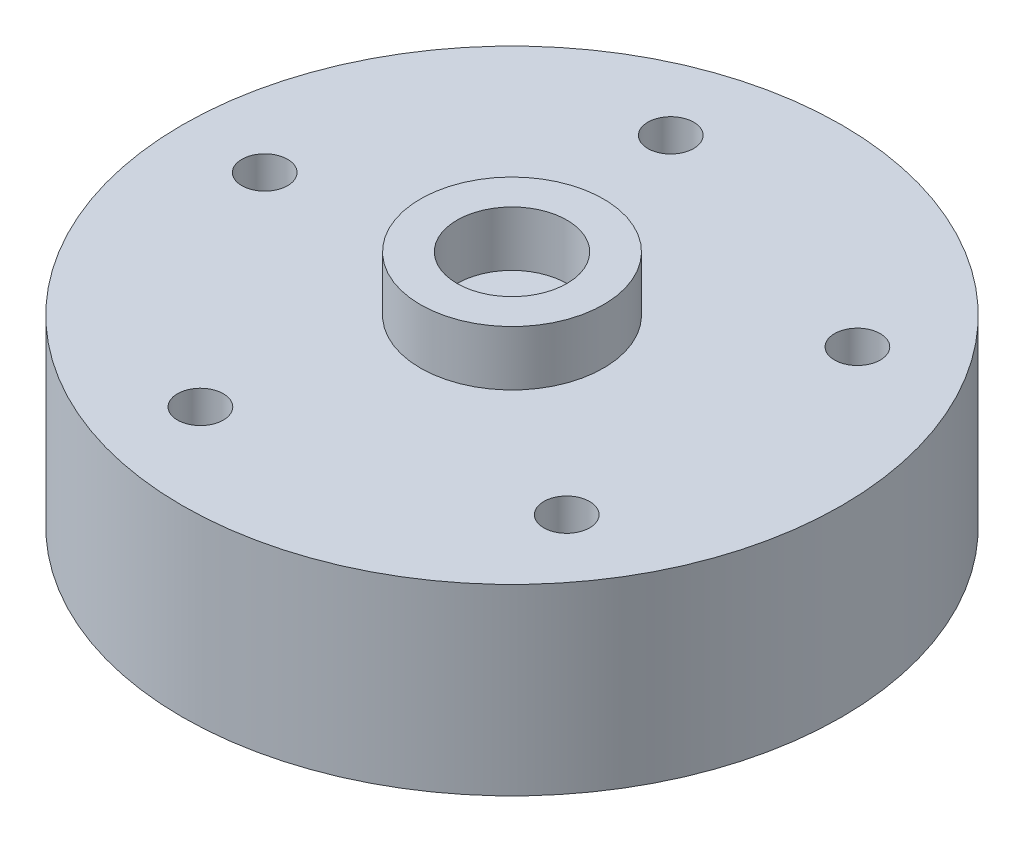
from build123d import *

# Parameters (mm, degrees)
BOSS_EXTRUDE1_DEPTH      = 2
BOSS_EXTRUDE1_DEPTH_BACK = 3
SKETCH1_R                = 16
SKETCH1_R_2              = 1.25
SKETCH2_R                = 5
SKETCH2_R_2              = 3
BOSS_EXTRUDE3_DEPTH      = 3
SKETCH5_R                = 2.75
CUT_EXTRUDE2_DEPTH       = 1
SKETCH6_R                = 16
SKETCH6_R_2              = 11
SKETCH6_R_3              = 1.25
BOSS_EXTRUDE4_DEPTH      = 5
SKETCH7_R                = 18
SKETCH7_R_2              = 16
BOSS_EXTRUDE5_DEPTH      = 10
SKETCH8_R                = 2
CUT_EXTRUDE3_DEPTH       = 3
SKETCH9_R                = 3.75
CUT_EXTRUDE4_DEPTH       = 2


with BuildPart() as part:
    # Sketch1 → Boss-Extrude1 (new, two sides: drawn at the far end of the back side and taken through both)
    with BuildSketch(Plane(origin=(0, 0, 0), x_dir=(1, 0, 0), z_dir=(0, 1, 0)).offset(-BOSS_EXTRUDE1_DEPTH_BACK)):
        with Locations(Location((0, 0, 0), (0, 0, 270))):
            Circle(SKETCH1_R)
        with Locations(Location((0, 0, 0), (0, 0, 270))):
            Circle(SKETCH1_R_2, mode=Mode.SUBTRACT)
        with Locations(Location((-13.5, 0, 0), (0, 0, 270))):
            Circle(SKETCH1_R_2, mode=Mode.SUBTRACT)
        with Locations(Location((-4.171729424, 12.83926297, 0), (0, 0, 270))):
            Circle(SKETCH1_R_2, mode=Mode.SUBTRACT)
        with Locations(Location((10.921729424, 7.935100906, 0), (0, 0, 270))):
            Circle(SKETCH1_R_2, mode=Mode.SUBTRACT)
        with Locations(Location((10.921729424, -7.935100906, 0), (0, 0, 270))):
            Circle(SKETCH1_R_2, mode=Mode.SUBTRACT)
        with Locations(Location((-4.171729424, -12.83926297, 0), (0, 0, 270))):
            Circle(SKETCH1_R_2, mode=Mode.SUBTRACT)
    extrude(amount=BOSS_EXTRUDE1_DEPTH + BOSS_EXTRUDE1_DEPTH_BACK)

    # Sketch2 → Boss-Extrude3 (add)
    with BuildSketch(Plane(origin=(0, 2, 0), x_dir=(1, 0, 0), z_dir=(0, 1, 0))):
        with Locations(Location((0, 0, 0), (0, 0, 270))):
            Circle(SKETCH2_R)
        with Locations(Location((0, 0, 0), (0, 0, 270))):
            Circle(SKETCH2_R_2, mode=Mode.SUBTRACT)
    extrude(amount=BOSS_EXTRUDE3_DEPTH)

    # Sketch5 → Cut-Extrude2 (cut)
    with BuildSketch(Plane.XZ.offset(3)):
        with Locations(Location((0, 0, 0), (0, 0, 270))):
            Circle(SKETCH5_R)
    extrude(amount=-CUT_EXTRUDE2_DEPTH, mode=Mode.SUBTRACT)

    # Sketch6 → Boss-Extrude4 (add)
    with BuildSketch(Plane.XZ.offset(3)):
        with Locations(Location((0, 0, 0), (0, 0, 90))):
            Circle(SKETCH6_R)
        with Locations(Location((0, 0, 0), (0, 0, 270))):
            Circle(SKETCH6_R_2, mode=Mode.SUBTRACT)
        with Locations(Location((-13.5, 0, 0), (0, 0, 90))):
            Circle(SKETCH6_R_3, mode=Mode.SUBTRACT)
        with Locations(Location((-4.171729424, 12.83926297, 0), (0, 0, 90))):
            Circle(SKETCH6_R_3, mode=Mode.SUBTRACT)
        with Locations(Location((10.921729424, 7.935100906, 0), (0, 0, 90))):
            Circle(SKETCH6_R_3, mode=Mode.SUBTRACT)
        with Locations(Location((10.921729424, -7.935100906, 0), (0, 0, 90))):
            Circle(SKETCH6_R_3, mode=Mode.SUBTRACT)
        with Locations(Location((-4.171729424, -12.83926297, 0), (0, 0, 90))):
            Circle(SKETCH6_R_3, mode=Mode.SUBTRACT)
    extrude(amount=BOSS_EXTRUDE4_DEPTH)

    # Sketch7 → Boss-Extrude5 (add)
    with BuildSketch(Plane(origin=(0, 2, 0), x_dir=(1, 0, 0), z_dir=(0, 1, 0))):
        with Locations(Location((0, 0, 0), (0, 0, 270))):
            Circle(SKETCH7_R)
        Circle(SKETCH7_R_2, mode=Mode.SUBTRACT)
    extrude(amount=-BOSS_EXTRUDE5_DEPTH)

    # Sketch8 → Cut-Extrude3 (cut)
    with BuildSketch(Plane.XZ.offset(2)):
        with Locations(Location((0, 0, 0), (0, 0, 270))):
            Circle(SKETCH8_R)
    extrude(amount=-CUT_EXTRUDE3_DEPTH, mode=Mode.SUBTRACT)

    # Sketch9 → Cut-Extrude4 (cut)
    with BuildSketch(Plane.XZ.offset(3)):
        with Locations(Location((0, 0, 0), (0, 0, 270))):
            Circle(SKETCH9_R)
    extrude(amount=-CUT_EXTRUDE4_DEPTH, mode=Mode.SUBTRACT)


solid = part.part
